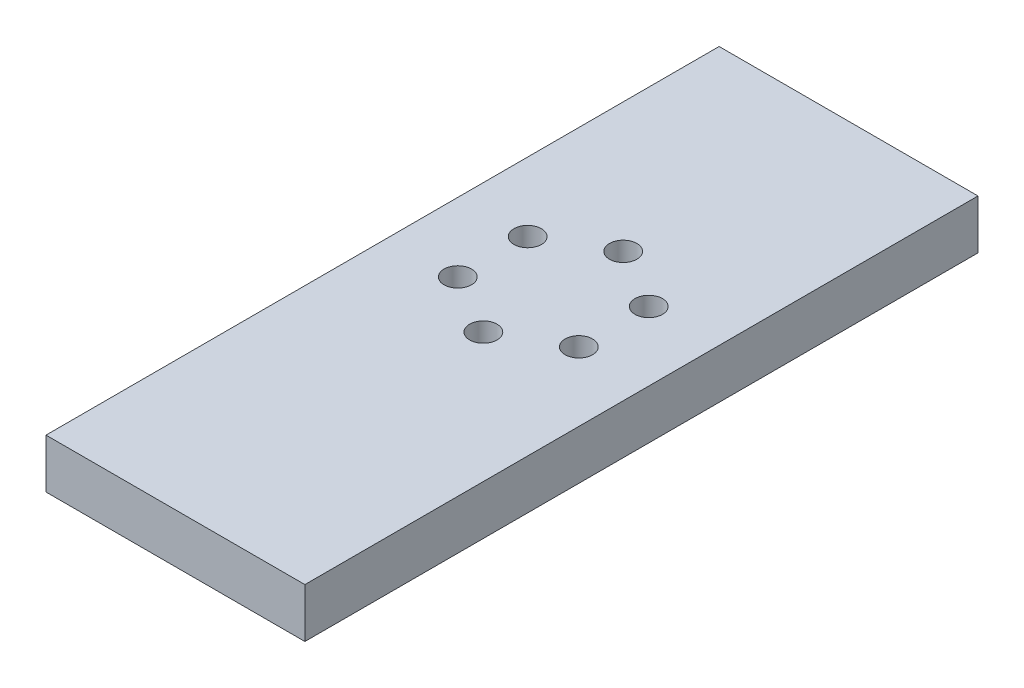
from build123d import *

# Parameters (mm, degrees)
SKETCH1_W                 = 50
SKETCH1_H                 = 130
BOSS_EXTRUDE1_DEPTH       = 9.525
F_4_0MM_DOWEL_HOLE1_D     = 4
F_4_0MM_DOWEL_HOLE1_DEPTH = 3.2
F_4_0MM_DOWEL_HOLE1_TIP   = 1.201721238
M5_CLEARANCE_HOLE1_D      = 5.3


with BuildPart() as part:
    # Sketch1 → Boss-Extrude1 (new body)
    with BuildSketch(Plane(origin=(0, 0, 0), x_dir=(1, 0, 0), z_dir=(0, 1, 0))):
        Rectangle(SKETCH1_W, SKETCH1_H)
    extrude(amount=BOSS_EXTRUDE1_DEPTH)

    # Ø4.0mm Dowel Hole1
    with Locations(Plane.XZ):
        with Locations((-16.67, 60.2375), (-16.67, -60.2375), (0, -60.2375), (16.67, -60.2375), (16.67, 35.7), (0, 35.7), (-16.67, 35.7), (16.67, 60.2375), (0, 60.2375)):
            Hole(F_4_0MM_DOWEL_HOLE1_D / 2, depth=F_4_0MM_DOWEL_HOLE1_DEPTH)
            with Locations((0, 0, -(F_4_0MM_DOWEL_HOLE1_DEPTH + F_4_0MM_DOWEL_HOLE1_TIP / 2))):  # 118° drill point
                Cone(0, F_4_0MM_DOWEL_HOLE1_D / 2, F_4_0MM_DOWEL_HOLE1_TIP, mode=Mode.SUBTRACT)

    # M5 Clearance Hole1 (through all)
    with Locations(Plane(origin=(0, 9.525, 0), x_dir=(1, 0, 0), z_dir=(0, 1, 0))):
        with Locations((-11.691342951, 14.72), (0, 21.47), (11.691342951, 14.72), (11.691342951, 1.22), (0, -5.53), (-11.691342951, 1.22)):
            Hole(M5_CLEARANCE_HOLE1_D / 2)


solid = part.part
